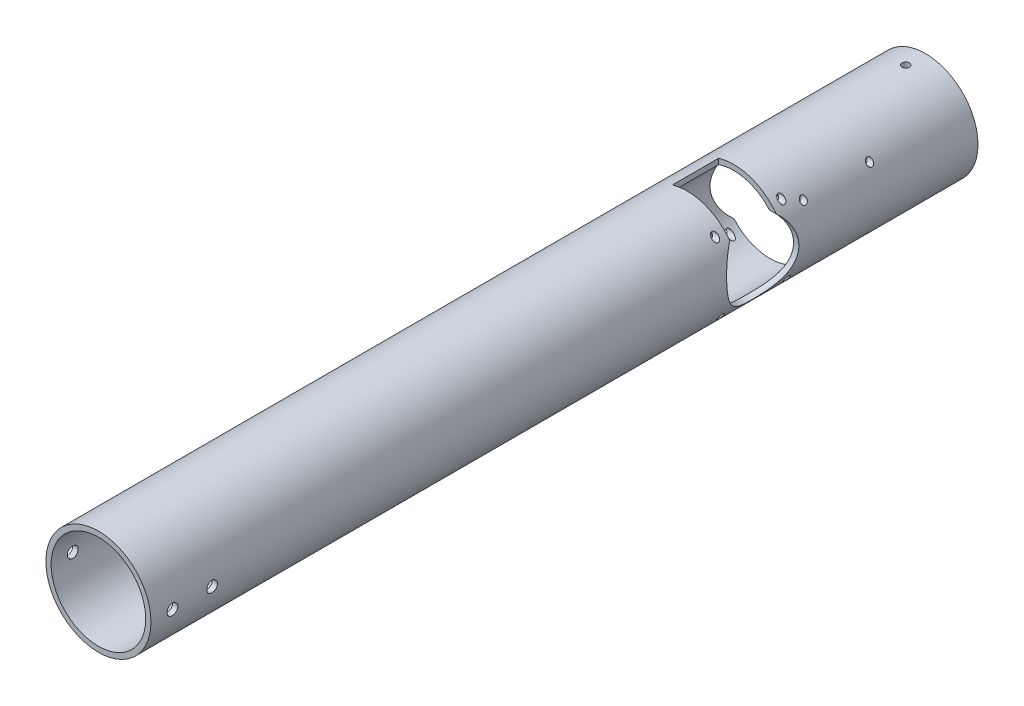
from build123d import *

# Parameters (mm, degrees)
BOSS_EXTRUDE1_DEPTH      = 250
BOSS_EXTRUDE1_DEPTH_BACK = 250
SKETCH1_R                = 31.75
SKETCH1_R_2              = 28.575
SKETCH2_R                = 21.75
CUT_EXTRUDE1_DEPTH       = 255.000246063
SKETCH3_R                = 21.75
CUT_EXTRUDE2_DEPTH       = 255.000246186
CUT_EXTRUDE4_START       = 9
SKETCH5_W                = 28
SKETCH5_H                = 22
CUT_EXTRUDE4_DEPTH       = 264.000246186
CUT_EXTRUDE5_START       = -9
SKETCH6_W                = 28
SKETCH6_H                = 22
CUT_EXTRUDE5_DEPTH       = 264.000246186
CUT_EXTRUDE8_DEPTH       = 255.000246186
CUT_EXTRUDE8_DEPTH_BACK  = 255.000246186
SKETCH11_R               = 2
CUT_EXTRUDE10_DEPTH      = 255.000246186
CUT_EXTRUDE10_DEPTH_BACK = 255.000246186
SKETCH12_R               = 3.25
CUT_EXTRUDE11_DEPTH      = 255.000246186
CUT_EXTRUDE11_DEPTH_BACK = 255.000246186
SKETCH13_R               = 2.25
CUT_EXTRUDE12_DEPTH      = 255.000246189
CUT_EXTRUDE12_DEPTH_BACK = 255.000246189
SKETCH15_R               = 2


with BuildPart() as part:
    # Sketch1 → Boss-Extrude1 (new, two sides: drawn at the far end of the back side and taken through both)
    with BuildSketch(Plane.XY.offset(-BOSS_EXTRUDE1_DEPTH_BACK)):
        Circle(SKETCH1_R)
        Circle(SKETCH1_R_2, mode=Mode.SUBTRACT)
    extrude(amount=BOSS_EXTRUDE1_DEPTH + BOSS_EXTRUDE1_DEPTH_BACK)

    # Sketch2 → Cut-Extrude1 (cut, through all)
    with BuildSketch(Plane(origin=(0, 0, 0), x_dir=(0, 0, -1), z_dir=(1, 0, 0))):
        with Locations((170, -2)):
            Circle(SKETCH2_R)
    extrude(amount=-CUT_EXTRUDE1_DEPTH, mode=Mode.SUBTRACT)

    # Sketch3 → Cut-Extrude2 (cut, through all)
    with BuildSketch(Plane(origin=(0, 0, 0), x_dir=(0, 0, -1), z_dir=(1, 0, 0))):
        with Locations((120, 2)):
            Circle(SKETCH3_R)
    extrude(amount=CUT_EXTRUDE2_DEPTH, mode=Mode.SUBTRACT)

    # Sketch5 → Cut-Extrude4 (cut, through all)
    with BuildSketch(Plane(origin=(0, 0, 0), x_dir=(0, 0, -1), z_dir=(1, 0, 0)).offset(CUT_EXTRUDE4_START)):
        with Locations((170, -23.75)):
            Rectangle(SKETCH5_W, SKETCH5_H)
    extrude(amount=-CUT_EXTRUDE4_DEPTH, mode=Mode.SUBTRACT)

    # Sketch6 → Cut-Extrude5 (cut, through all)
    with BuildSketch(Plane(origin=(0, 0, 0), x_dir=(0, 0, -1), z_dir=(1, 0, 0)).offset(CUT_EXTRUDE5_START)):
        with Locations((120, 23.75)):
            Rectangle(SKETCH6_W, SKETCH6_H)
    extrude(amount=CUT_EXTRUDE5_DEPTH, mode=Mode.SUBTRACT)

    # Sketch11 → Cut-Extrude8 (cut, two sides: drawn at the far end of the back side and taken through both)
    with BuildSketch(Plane(origin=(0, 0, 0), x_dir=(0, 0, -1), z_dir=(1, 0, 0)).offset(-CUT_EXTRUDE8_DEPTH_BACK)):
        with Locations((190, 18)):
            Circle(SKETCH11_R)
        with Locations((150, 18)):
            Circle(SKETCH11_R)
        with Locations((150, -22)):
            Circle(SKETCH11_R)
        with Locations((190, -22)):
            Circle(SKETCH11_R)
    extrude(amount=CUT_EXTRUDE8_DEPTH + CUT_EXTRUDE8_DEPTH_BACK, mode=Mode.SUBTRACT)

    # Sketch12 → Cut-Extrude10 (cut, two sides: drawn at the far end of the back side and taken through both)
    with BuildSketch(Plane(origin=(0, 0, 0), x_dir=(0, 0, -1), z_dir=(1, 0, 0)).offset(-CUT_EXTRUDE10_DEPTH_BACK)):
        with Locations((-213, 0)):
            Circle(SKETCH12_R)
        with Locations((-237, 0)):
            Circle(SKETCH12_R)
    extrude(amount=CUT_EXTRUDE10_DEPTH + CUT_EXTRUDE10_DEPTH_BACK, mode=Mode.SUBTRACT)

    # Sketch13 → Cut-Extrude11 (cut, two sides: drawn at the far end of the back side and taken through both)
    with BuildSketch(Plane(origin=(0, 0, 0), x_dir=(1, 0, 0), z_dir=(0, 1, 0)).offset(-CUT_EXTRUDE11_DEPTH_BACK)):
        with Locations((0, 238)):
            Circle(SKETCH13_R)
    extrude(amount=CUT_EXTRUDE11_DEPTH + CUT_EXTRUDE11_DEPTH_BACK, mode=Mode.SUBTRACT)

    # Sketch15 → Cut-Extrude12 (cut, two sides: drawn at the far end of the back side and taken through both)
    with BuildSketch(Plane(origin=(0, 0, 0), x_dir=(0, 0, -1), z_dir=(1, 0, 0)).offset(-CUT_EXTRUDE12_DEPTH_BACK)):
        with Locations((100, 22)):
            Circle(SKETCH15_R)
        with Locations((140, 22)):
            Circle(SKETCH15_R)
        with Locations((140, -18)):
            Circle(SKETCH15_R)
        with Locations((100, -18)):
            Circle(SKETCH15_R)
    extrude(amount=CUT_EXTRUDE12_DEPTH + CUT_EXTRUDE12_DEPTH_BACK, mode=Mode.SUBTRACT)


solid = part.part
